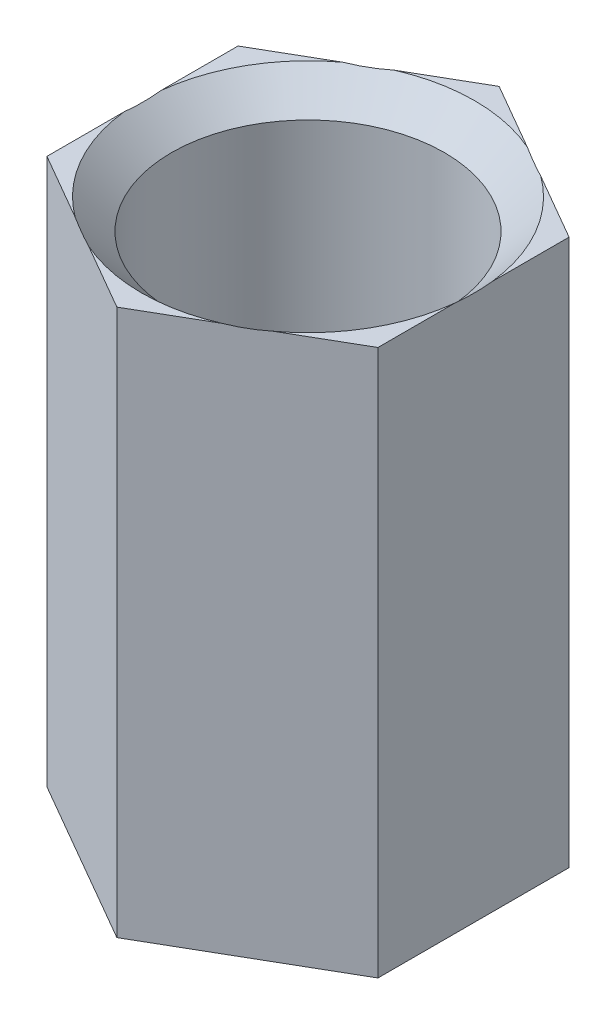
from build123d import *

# Parameters (mm, degrees)
BOSS_EXTRUDE2_DEPTH         = 5
M3_TAPPED_HOLE1_D           = 2.5
M3_TAPPED_HOLE1_CSINK_D     = 3.05
M3_TAPPED_HOLE1_CSINK_ANGLE = 90


with BuildPart() as part:
    # Sketch1 → Boss-Extrude2 (new body)
    with BuildSketch(Plane(origin=(0, 0, 0), x_dir=(1, 0, 0), z_dir=(0, 1, 0))):
        with BuildLine():
            Line((-1.515544457, -0.875), (-1.299038106, -0.75))
            ThreePointArc((-1.299038106, -0.75), (-1.5, 0), (-1.299038106, 0.75))
            Line((-1.299038106, 0.75), (-1.515544457, 0.875))
            Line((-1.515544457, 0.875), (-1.515544457, -0.875))
        make_face()
        with BuildLine():
            Line((-1.299038106, -0.75), (0, 0))
            Line((0, 0), (-1.299038106, 0.75))
            ThreePointArc((-1.299038106, 0.75), (-1.5, 0), (-1.299038106, -0.75))
        make_face()
        with BuildLine():
            Line((0, -1.75), (0, -1.5))
            ThreePointArc((0, -1.5), (-0.75, -1.299038106), (-1.299038106, -0.75))
            Line((-1.299038106, -0.75), (-1.515544457, -0.875))
            Line((-1.515544457, -0.875), (0, -1.75))
        make_face()
        with BuildLine():
            Line((0, -1.5), (0, 0))
            Line((0, 0), (-1.299038106, -0.75))
            ThreePointArc((-1.299038106, -0.75), (-0.75, -1.299038106), (0, -1.5))
        make_face()
        with BuildLine():
            Line((1.299038106, -0.75), (0, 0))
            Line((0, 0), (0, -1.5))
            ThreePointArc((0, -1.5), (0.75, -1.299038106), (1.299038106, -0.75))
        make_face()
        with BuildLine():
            Line((1.299038106, 0.75), (0, 0))
            Line((0, 0), (1.299038106, -0.75))
            ThreePointArc((1.299038106, -0.75), (1.448888739, -0.388228568), (1.5, 0))
            ThreePointArc((1.5, 0), (1.448888739, 0.388228568), (1.299038106, 0.75))
        make_face()
        with BuildLine():
            Line((0.75, 1.299038106), (0, 0))
            Line((0, 0), (1.299038106, 0.75))
            ThreePointArc((1.299038106, 0.75), (1.060660172, 1.060660172), (0.75, 1.299038106))
        make_face()
        with BuildLine():
            Line((0, 1.5), (0, 0))
            Line((0, 0), (0.75, 1.299038106))
            ThreePointArc((0.75, 1.299038106), (0.388228568, 1.448888739), (0, 1.5))
        make_face()
        with BuildLine():
            Line((-1.299038106, 0.75), (0, 0))
            Line((0, 0), (0, 1.5))
            ThreePointArc((0, 1.5), (-0.75, 1.299038106), (-1.299038106, 0.75))
        make_face()
        with BuildLine():
            ThreePointArc((-1.299038106, 0.75), (-0.75, 1.299038106), (0, 1.5))
            Line((0, 1.5), (0, 1.75))
            Line((0, 1.75), (-1.515544457, 0.875))
            Line((-1.515544457, 0.875), (-1.299038106, 0.75))
        make_face()
        with BuildLine():
            Line((0, 1.75), (0, 1.5))
            ThreePointArc((0, 1.5), (0.388228568, 1.448888739), (0.75, 1.299038106))
            ThreePointArc((0.75, 1.299038106), (1.060660172, 1.060660172), (1.299038106, 0.75))
            Line((1.299038106, 0.75), (1.515544457, 0.875))
            Line((1.515544457, 0.875), (0, 1.75))
        make_face()
        with BuildLine():
            Line((1.515544457, 0.875), (1.299038106, 0.75))
            ThreePointArc((1.299038106, 0.75), (1.448888739, 0.388228568), (1.5, 0))
            ThreePointArc((1.5, 0), (1.448888739, -0.388228568), (1.299038106, -0.75))
            Line((1.299038106, -0.75), (1.515544457, -0.875))
            Line((1.515544457, -0.875), (1.515544457, 0.875))
        make_face()
        with BuildLine():
            Line((1.515544457, -0.875), (1.299038106, -0.75))
            ThreePointArc((1.299038106, -0.75), (0.75, -1.299038106), (0, -1.5))
            Line((0, -1.5), (0, -1.75))
            Line((0, -1.75), (1.515544457, -0.875))
        make_face()
    extrude(amount=BOSS_EXTRUDE2_DEPTH)

    # M3 Tapped Hole1 (through all)
    with Locations(Plane(origin=(0, 5, 0), x_dir=(1, 0, 0), z_dir=(0, 1, 0))):
        with Locations((0, 0)):
            CounterSinkHole(M3_TAPPED_HOLE1_D / 2, M3_TAPPED_HOLE1_CSINK_D / 2, counter_sink_angle=M3_TAPPED_HOLE1_CSINK_ANGLE)


solid = part.part
